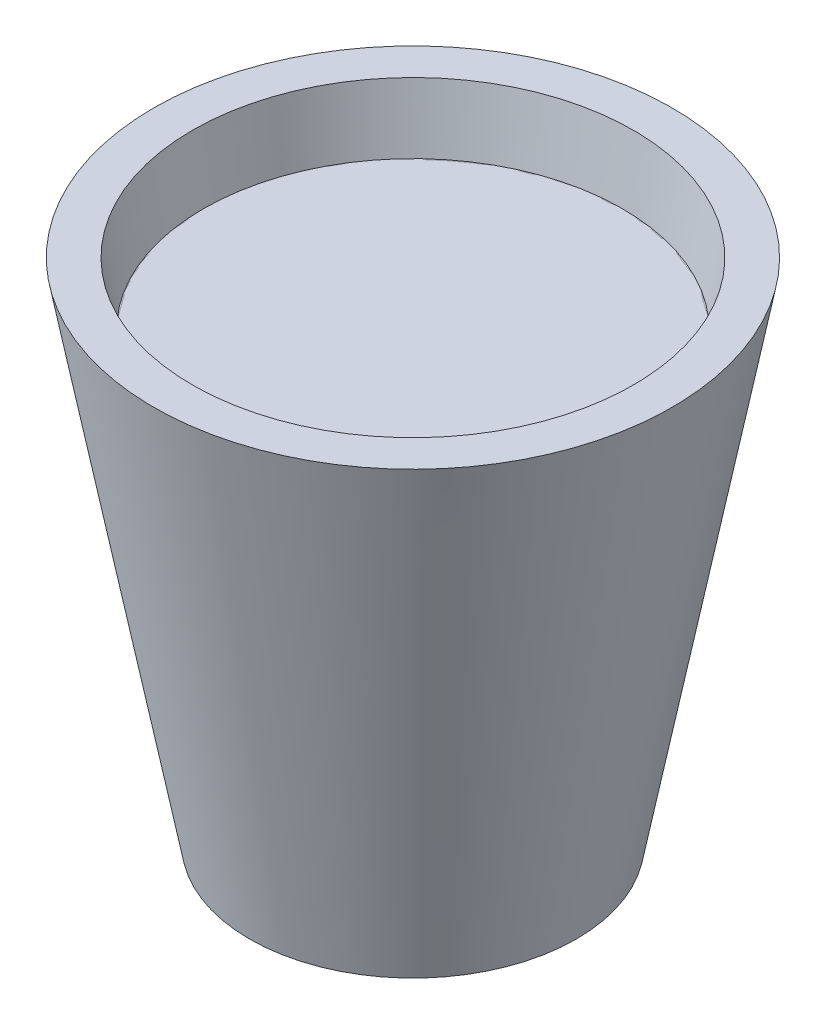
from build123d import *

# Parameters (mm, degrees)
SKETCH3_R           = 38.567705457
BOSS_EXTRUDE2_DEPTH = 81.026
BOSS_EXTRUDE2_DRAFT = -10
SKETCH5_R           = 38.567705457
CUT_EXTRUDE3_DEPTH  = 10.922
CUT_EXTRUDE3_DRAFT  = -10


with BuildPart() as part:
    # Sketch1 → Revolve2 (revolve)
    with BuildSketch(Plane.XY, mode=Mode.PRIVATE) as revolve2_sk:
        Polygon((0, 0), (28.575, 0), (45.330735358, 88.9), (38.567705457, 88.9), (22.889249359, 8.32891688), (0, 8.32891688), align=None)
    revolve(revolve2_sk.sketch.rotate(Axis((0, 8.32891688, 0), (0, -1, 0)), 180), axis=Axis((0, 8.32891688, 0), (0, -1, 0)))


with BuildPart() as body_2:
    # Sketch3 → Boss-Extrude2 (with draft: the straight prism first)
    with BuildSketch(Plane(origin=(0, 88.9, 0), x_dir=(1, 0, 0), z_dir=(0, 1, 0))):
        Circle(SKETCH3_R)
    extrude(amount=-BOSS_EXTRUDE2_DEPTH)
    # Boss-Extrude2: the draft: its side faces are tilted about the plane it starts from
    boss_extrude2_sides = [body_2.faces().sort_by_distance(p)[0] for p in [
        (-38.567705457, 48.387, 0),
    ]]
    draft(boss_extrude2_sides, Plane(origin=(0, 88.9, 0), x_dir=(1, 0, 0), z_dir=(0, 1, 0)), BOSS_EXTRUDE2_DRAFT)


with BuildPart() as cut_extrude3_tool:
    # Sketch5 → Cut-Extrude3 (with draft: the straight prism first)
    with BuildSketch(Plane(origin=(0, 88.9, 0), x_dir=(1, 0, 0), z_dir=(0, 1, 0))):
        Circle(SKETCH5_R)
    extrude(amount=-CUT_EXTRUDE3_DEPTH)
    # Cut-Extrude3: the draft: its side faces are tilted about the plane it starts from
    cut_extrude3_sides = [cut_extrude3_tool.faces().sort_by_distance(p)[0] for p in [
        (-38.567705457, 83.439, 0),
    ]]
    draft(cut_extrude3_sides, Plane(origin=(0, 88.9, 0), x_dir=(1, 0, 0), z_dir=(0, 1, 0)), CUT_EXTRUDE3_DRAFT)


with BuildPart() as part_1:
    add(part.part)

    # Cut-Extrude3: cut by cut_extrude3_tool
    add(cut_extrude3_tool.part, mode=Mode.SUBTRACT)


with BuildPart() as body_2_1:
    add(body_2.part)

    # Cut-Extrude3: cut by cut_extrude3_tool
    add(cut_extrude3_tool.part, mode=Mode.SUBTRACT)


solid = Compound([part_1.part, body_2_1.part])
